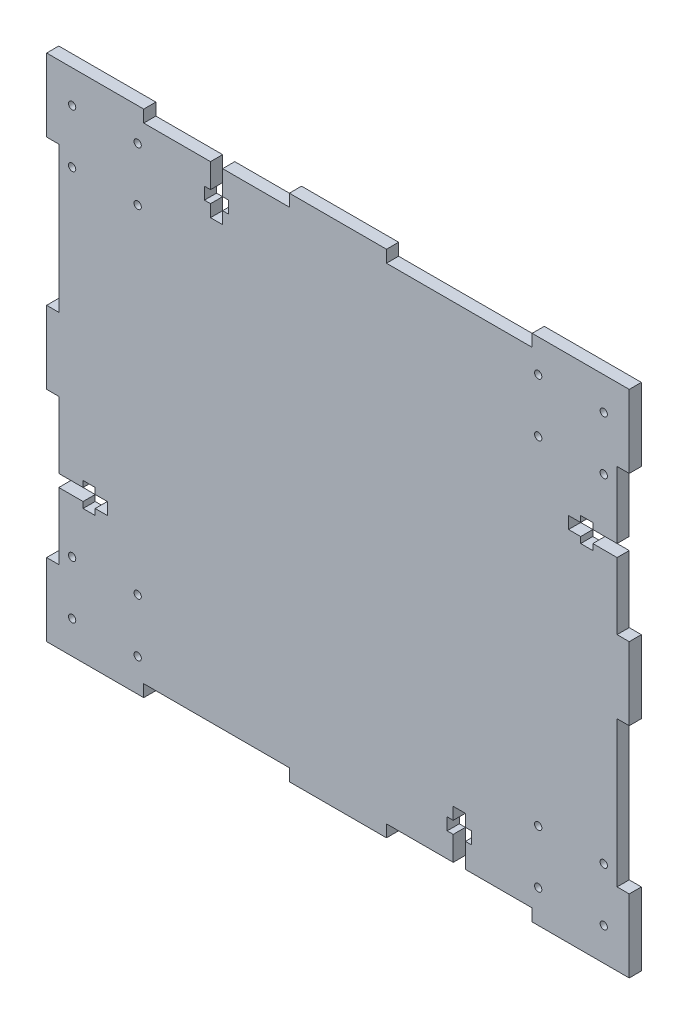
from build123d import *

# Parameters (mm, degrees)
ESQUISSE1_R        = 1.5
BOSS_EXTRU_1_DEPTH = 5


with BuildPart() as part:
    # Esquisse1 → Boss.-Extru.1 (new body)
    with BuildSketch(Plane.XY):
        Polygon((-25, 81.290322581), (15, 81.290322581), (15, 76.290322581), (75, 76.290322581), (75, 81.290322581), (115, 81.290322581), (115, 51.290322581), (110, 51.290322581), (110, 23.790322581), (100, 23.790322581), (100, 26.290322581), (95, 26.290322581), (95, 23.790322581), (90, 23.790322581), (90, 18.790322581), (95, 18.790322581), (95, 16.290322581), (100, 16.290322581), (100, 18.790322581), (110, 18.790322581), (110, -8.709677419), (115, -8.709677419), (115, -38.709677419), (110, -38.709677419), (110, -98.709677419), (115, -98.709677419), (115, -128.709677419), (75, -128.709677419), (75, -123.709677419), (47.5, -123.709677419), (47.5, -113.709677419), (50, -113.709677419), (50, -108.709677419), (47.5, -108.709677419), (47.5, -103.709677419), (42.5, -103.709677419), (42.5, -108.709677419), (40, -108.709677419), (40, -113.709677419), (42.5, -113.709677419), (42.5, -123.709677419), (15, -123.709677419), (15, -128.709677419), (-25, -128.709677419), (-25, -123.709677419), (-85, -123.709677419), (-85, -128.709677419), (-125, -128.709677419), (-125, -98.709677419), (-120, -98.709677419), (-120, -71.209677419), (-110, -71.209677419), (-110, -73.709677419), (-105, -73.709677419), (-105, -71.209677419), (-100, -71.209677419), (-100, -66.209677419), (-105, -66.209677419), (-105, -63.709677419), (-110, -63.709677419), (-110, -66.209677419), (-120, -66.209677419), (-120, -38.709677419), (-125, -38.709677419), (-125, -8.709677419), (-120, -8.709677419), (-120, 51.290322581), (-125, 51.290322581), (-125, 81.290322581), (-85, 81.290322581), (-85, 76.290322581), (-57.5, 76.290322581), (-57.5, 66.290322581), (-60, 66.290322581), (-60, 61.290322581), (-57.5, 61.290322581), (-57.5, 56.290322581), (-52.5, 56.290322581), (-52.5, 61.290322581), (-50, 61.290322581), (-50, 66.290322581), (-52.5, 66.290322581), (-52.5, 76.290322581), (-25, 76.290322581), align=None)
        with Locations((-114.5, -93.209677419)):
            Circle(ESQUISSE1_R, mode=Mode.SUBTRACT)
        with Locations((-114.5, -115.209677419)):
            Circle(ESQUISSE1_R, mode=Mode.SUBTRACT)
        with Locations((-87.5, -115.209677419)):
            Circle(ESQUISSE1_R, mode=Mode.SUBTRACT)
        with Locations((-87.5, -93.209677419)):
            Circle(ESQUISSE1_R, mode=Mode.SUBTRACT)
        with Locations(Location((-87.5, 45.790322581, 0), (0, 0, 180))):
            Circle(ESQUISSE1_R, mode=Mode.SUBTRACT)
        with Locations(Location((-87.5, 67.790322581, 0), (0, 0, 180))):
            Circle(ESQUISSE1_R, mode=Mode.SUBTRACT)
        with Locations(Location((-114.5, 67.790322581, 0), (0, 0, 180))):
            Circle(ESQUISSE1_R, mode=Mode.SUBTRACT)
        with Locations(Location((-114.5, 45.790322581, 0), (0, 0, 180))):
            Circle(ESQUISSE1_R, mode=Mode.SUBTRACT)
        with Locations((104.5, 67.790322581)):
            Circle(ESQUISSE1_R, mode=Mode.SUBTRACT)
        with Locations((104.5, 45.790322581)):
            Circle(ESQUISSE1_R, mode=Mode.SUBTRACT)
        with Locations((77.5, 45.790322581)):
            Circle(ESQUISSE1_R, mode=Mode.SUBTRACT)
        with Locations((77.5, 67.790322581)):
            Circle(ESQUISSE1_R, mode=Mode.SUBTRACT)
        with Locations(Location((104.5, -93.209677419, 0), (0, 0, 180))):
            Circle(ESQUISSE1_R, mode=Mode.SUBTRACT)
        with Locations(Location((104.5, -115.209677419, 0), (0, 0, 180))):
            Circle(ESQUISSE1_R, mode=Mode.SUBTRACT)
        with Locations(Location((77.5, -115.209677419, 0), (0, 0, 180))):
            Circle(ESQUISSE1_R, mode=Mode.SUBTRACT)
        with Locations(Location((77.5, -93.209677419, 0), (0, 0, 180))):
            Circle(ESQUISSE1_R, mode=Mode.SUBTRACT)
    extrude(amount=BOSS_EXTRU_1_DEPTH)


solid = part.part
